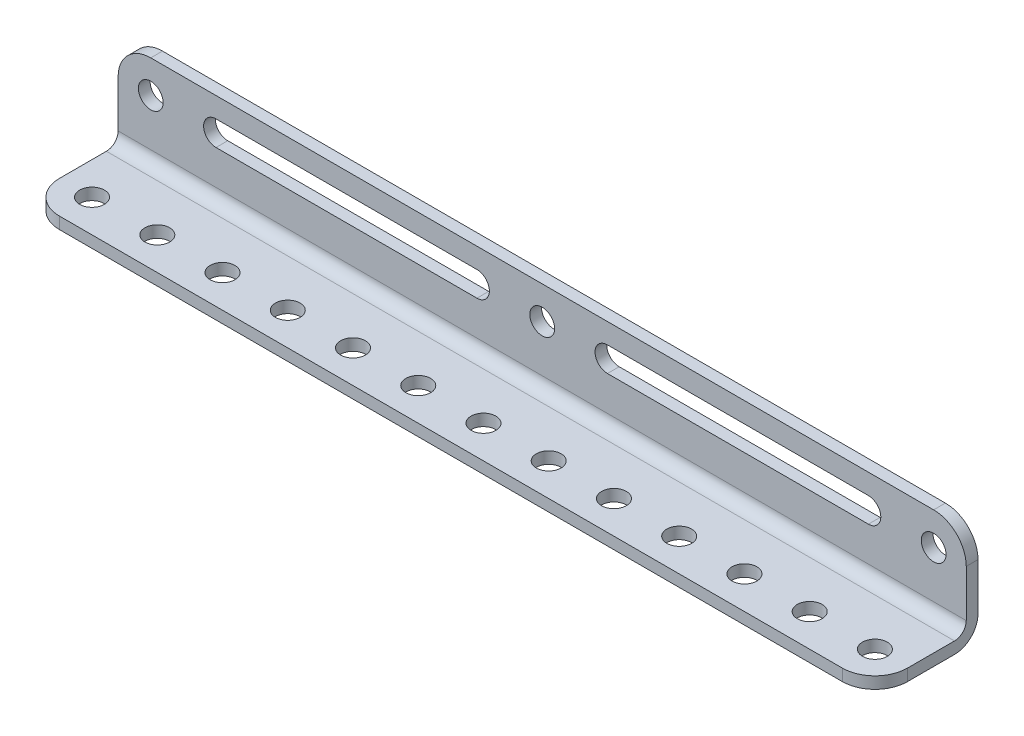
from build123d import *

# Parameters (mm, degrees)
EXTRUDE_THIN1_DEPTH = 82.55
SKETCH2_R           = 2.413
EXTRUDE2_DEPTH      = 87.794442541
LPATTERN1_COUNT     = 13
LPATTERN1_PITCH     = 12.7
FILLET1_R           = 6.35
SKETCH3_R           = 2.413
EXTRUDE3_DEPTH      = 87.294607595
LPATTERN2_COUNT     = 13
LPATTERN2_PITCH     = 76.2
EXTRUDE4_DEPTH      = 87.294607595


with BuildPart() as part:
    # Sketch1 → Extrude-Thin1 (new, symmetric)
    with BuildSketch(Plane(origin=(0, 0, 0), x_dir=(0, 0, -1), z_dir=(1, 0, 0))):
        with BuildLine():
            Line((0, 0), (15.494, 0))
            ThreePointArc((15.494, 0), (17.110446102, 0.669553898), (17.78, 2.286))
            Line((17.78, 2.286), (17.78, 17.78))
            Line((17.78, 17.78), (20.066, 17.78))
            Line((20.066, 17.78), (20.066, 2.286))
            ThreePointArc((20.066, 2.286), (18.726892204, -0.946892204), (15.494, -2.286))
            Line((15.494, -2.286), (0, -2.286))
            Line((0, -2.286), (0, 0))
        make_face()
    extrude(amount=EXTRUDE_THIN1_DEPTH, both=True)

    # Sketch2 → Extrude2 (cut, through all)
    with BuildSketch(Plane(origin=(0, 0, 0), x_dir=(-1, 0, 0), z_dir=(0, 1, 0))):
        with Locations(Location((76.2, -6.35, 0), (0, 0, 90))):
            Circle(SKETCH2_R)
    extrude2 = extrude(amount=-EXTRUDE2_DEPTH, mode=Mode.SUBTRACT)

    # LPattern1: Extrude2 ×13
    with Locations(*[(i * LPATTERN1_PITCH, 0, 0) for i in range(1, LPATTERN1_COUNT)]):
        add(extrude2, mode=Mode.SUBTRACT)

    # Fillet1
    fillet1_edges = [part.edges().sort_by_distance(p)[0] for p in [
        (82.55, -1.143, 0),
        (-82.55, -1.143, 0),
        (82.55, 17.78, -18.923),
        (-82.55, 17.78, -18.923),
    ]]
    fillet(fillet1_edges, radius=FILLET1_R)

    # Sketch3 → Extrude3 (cut, through all)
    with BuildSketch(Plane.XY.offset(-17.78)):
        with Locations((-76.2, 11.43)):
            Circle(SKETCH3_R)
    extrude3 = extrude(amount=-EXTRUDE3_DEPTH, mode=Mode.SUBTRACT)

    # LPattern2: Extrude3 ×13
    with Locations(*[(i * LPATTERN2_PITCH, 0, 0) for i in range(1, LPATTERN2_COUNT)]):
        add(extrude3, mode=Mode.SUBTRACT)

    # Sketch4 → Extrude4 (cut, through all)
    with BuildSketch(Plane.XY.offset(-17.78)):
        with BuildLine():
            Line((-63.5, 13.843), (-12.7, 13.843))
            ThreePointArc((-12.7, 13.843), (-10.287, 11.43), (-12.7, 9.017))
            Line((-12.7, 9.017), (-63.5, 9.017))
            ThreePointArc((-63.5, 9.017), (-65.913, 11.43), (-63.5, 13.843))
        make_face()
        with BuildLine():
            Line((63.5, 13.843), (12.7, 13.843))
            ThreePointArc((12.7, 13.843), (10.287, 11.43), (12.7, 9.017))
            Line((12.7, 9.017), (63.5, 9.017))
            ThreePointArc((63.5, 9.017), (65.913, 11.43), (63.5, 13.843))
        make_face()
    extrude(amount=-EXTRUDE4_DEPTH, mode=Mode.SUBTRACT)


solid = part.part
